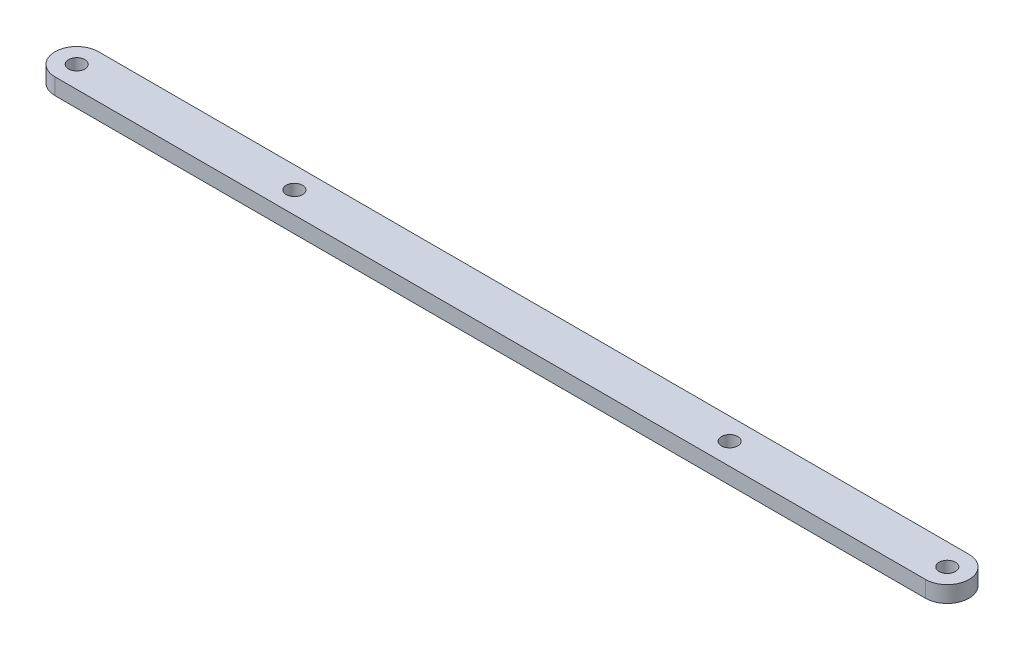
from build123d import *

# Parameters (mm, degrees)
SKETCH1_R           = 1.5
BOSS_EXTRUDE1_DEPTH = 3
SKETCH4_R           = 1.5
CUT_EXTRUDE4_DEPTH  = 165.076201809


with BuildPart() as part:
    # Sketch1 → Boss-Extrude1 (new body)
    with BuildSketch(Plane(origin=(0, 0, 0), x_dir=(1, 0, 0), z_dir=(0, 1, 0))):
        with BuildLine():
            Line((0, 4), (160, 4))
            ThreePointArc((160, 4), (164, 0), (160, -4))
            Line((160, -4), (0, -4))
            ThreePointArc((0, -4), (-4, 0), (0, 4))
        make_face()
        with Locations(Location((0, 0, 0), (0, 0, 270))):
            Circle(SKETCH1_R, mode=Mode.SUBTRACT)
        with Locations(Location((160, 0, 0), (0, 0, 270))):
            Circle(SKETCH1_R, mode=Mode.SUBTRACT)
        with Locations(Location((120, 0, 0), (0, 0, 270))):
            Circle(SKETCH1_R, mode=Mode.SUBTRACT)
    extrude(amount=BOSS_EXTRUDE1_DEPTH)

    # Sketch4 → Cut-Extrude4 (cut, through all)
    with BuildSketch(Plane(origin=(0, 0, 0), x_dir=(1, 0, 0), z_dir=(0, 1, 0))):
        with Locations(Location((40, 0, 0), (0, 0, 270))):
            Circle(SKETCH4_R)
    extrude(amount=CUT_EXTRUDE4_DEPTH, mode=Mode.SUBTRACT)


solid = part.part
